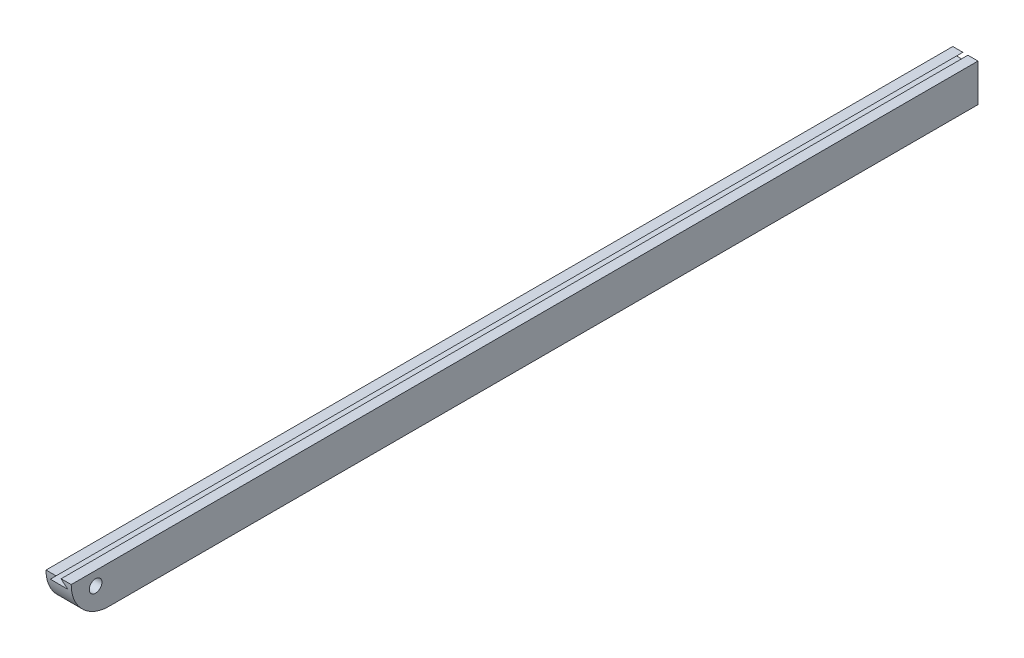
from build123d import *

# Parameters (mm, degrees)
BOSS_EXTRUDE1_DEPTH = 457.2
CUT_EXTRUDE1_DEPTH  = 458.772904943
SKETCH3_R           = 3.175
CUT_EXTRUDE2_DEPTH  = 458.772904943
SKETCH4_R           = 4.445
CUT_EXTRUDE3_DEPTH  = 406.4


with BuildPart() as part:
    # Sketch1 → Boss-Extrude1 (new body)
    with BuildSketch(Plane.XY):
        Polygon((5.08, 0), (1.905, -3.175), (10.795, -3.175), (7.62, 0), (12.7, 0), (12.7, -19.05), (0, -19.05), (0, 0), align=None)
    extrude(amount=BOSS_EXTRUDE1_DEPTH)

    # Sketch2 → Cut-Extrude1 (cut, through all)
    with BuildSketch(Plane(origin=(12.7, 0, 0), x_dir=(0, 0, -1), z_dir=(1, 0, 0))):
        with BuildLine():
            Line((-457.2, 0), (-457.2, -19.05))
            Line((-457.2, -19.05), (-438.15, -19.05))
            ThreePointArc((-438.15, -19.05), (-451.620384182, -13.470384182), (-457.2, 0))
        make_face()
    extrude(amount=-CUT_EXTRUDE1_DEPTH, mode=Mode.SUBTRACT)

    # Sketch3 → Cut-Extrude2 (cut, through all)
    with BuildSketch(Plane(origin=(12.7, 0, 0), x_dir=(0, 0, -1), z_dir=(1, 0, 0))):
        with Locations(Location((-444.885192091, -6.735192091, 0), (0, 0, 90))):
            Circle(SKETCH3_R)
    extrude(amount=-CUT_EXTRUDE2_DEPTH, mode=Mode.SUBTRACT)

    # Sketch4 → Cut-Extrude3 (cut)
    with BuildSketch(Plane(origin=(0, 0, 0), x_dir=(-1, 0, 0), z_dir=(0, 0, -1))):
        with Locations((-6.35, -11.43)):
            Circle(SKETCH4_R)
    extrude(amount=-CUT_EXTRUDE3_DEPTH, mode=Mode.SUBTRACT)


solid = part.part
